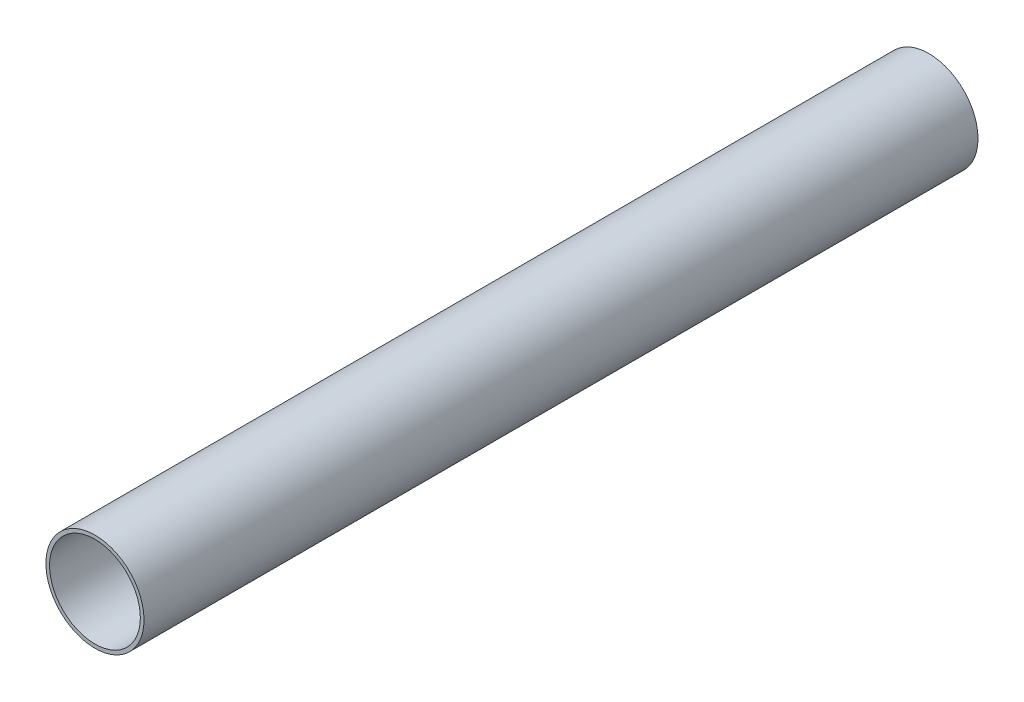
from build123d import *

# Parameters (mm, degrees)
SKETCH1_R           = 8
SKETCH1_R_2         = 7.4
BOSS_EXTRUDE1_DEPTH = 136


with BuildPart() as part:
    # Sketch1 → Boss-Extrude1 (new body)
    with BuildSketch(Plane.XY):
        Circle(SKETCH1_R)
        Circle(SKETCH1_R_2, mode=Mode.SUBTRACT)
    extrude(amount=BOSS_EXTRUDE1_DEPTH)


solid = part.part
